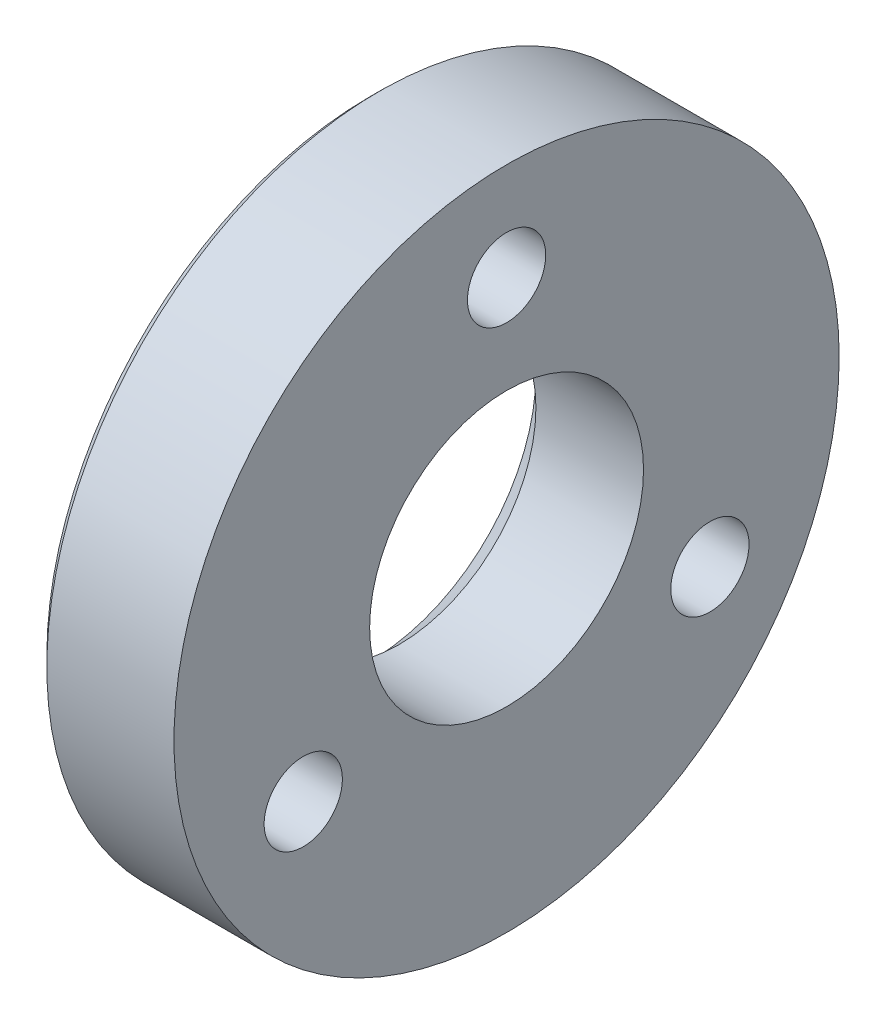
from build123d import *

# Parameters (mm, degrees)
SKETCH_1_R               = 17
SKETCH_1_R_2             = 7
EXTRUDE_1_DEPTH          = 7
CHAMFER_1_SIZE           = 0.5
CHAMFER_2_SIZE           = 1.5
CUT_EXTRUDE_1_DEPTH      = 26.039968051
CUT_EXTRUDE_1_DEPTH_BACK = 26.039968051
SKETCH_2_R               = 2
CUT_EXTRUDE_START        = -3
SKETCH_3_R               = 3
CUT_EXTRUDE_2_DEPTH      = 29.039968051
PATTERN_CIRCULAR_1_COUNT = 3


with BuildPart() as part:
    # 草图1 → 凸台-拉伸1 (new body)
    with BuildSketch(Plane(origin=(0, 0, 0), x_dir=(0, 0, -1), z_dir=(1, 0, 0))):
        Circle(SKETCH_1_R)
        Circle(SKETCH_1_R_2, mode=Mode.SUBTRACT)
    extrude(amount=EXTRUDE_1_DEPTH)

    # 倒角1
    chamfer_1_edges = [part.edges().sort_by_distance(p)[0] for p in [
        (0, 0, 17),
    ]]
    chamfer(chamfer_1_edges, length=CHAMFER_1_SIZE)

    # 倒角2
    chamfer_2_edges = [part.edges().sort_by_distance(p)[0] for p in [
        (0, 0, 7),
    ]]
    chamfer(chamfer_2_edges, length=CHAMFER_2_SIZE)

    # 草图2 → 切除-拉伸1 (cut, two sides: drawn at the far end of the back side and taken through both)
    with BuildSketch(Plane(origin=(0, 0, 0), x_dir=(0, 0, -1), z_dir=(1, 0, 0)).offset(-CUT_EXTRUDE_1_DEPTH_BACK)):
        with Locations((0, 12)):
            Circle(SKETCH_2_R)
        with Locations((10.392304845, -6)):
            Circle(SKETCH_2_R)
        with Locations((-10.392304845, -6)):
            Circle(SKETCH_2_R)
    extrude(amount=CUT_EXTRUDE_1_DEPTH + CUT_EXTRUDE_1_DEPTH_BACK, mode=Mode.SUBTRACT)

    # 草图3 → 切除-拉伸2 (cut)
    with BuildSketch(Plane.ZY.offset(CUT_EXTRUDE_START)):
        with Locations(Location((0, 12, 0), (0, 0, 180))):
            Circle(SKETCH_3_R)
    cut_extrude_2 = extrude(amount=CUT_EXTRUDE_2_DEPTH, mode=Mode.SUBTRACT)

    # 阵列(圆周)1: 切除-拉伸2 ×3 about axis
    pattern_circular_1_axis = Axis((0, 0, 0), (1, 0, 0))
    for i in range(1, PATTERN_CIRCULAR_1_COUNT):
        add(cut_extrude_2.rotate(pattern_circular_1_axis, i * 360 / PATTERN_CIRCULAR_1_COUNT), mode=Mode.SUBTRACT)


solid = part.part
